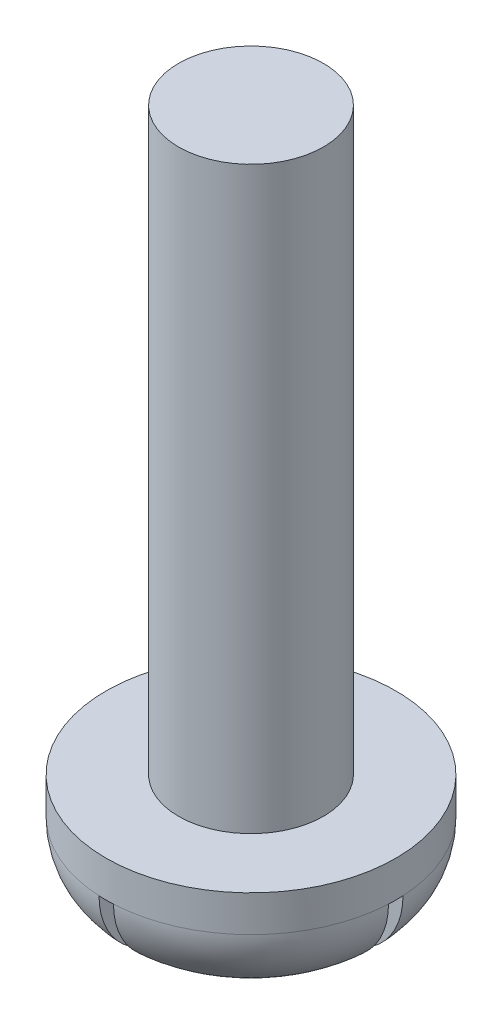
from build123d import *

# Parameters (mm, degrees)
SKETCH_1_R               = 2
EXTRUDE_1_DEPTH          = 1.5
SKETCH_2_R               = 1
EXTRUDE_2_DEPTH          = 8
CUT_EXTRUDE_1_DEPTH      = 10.912113801
CUT_EXTRUDE_1_DEPTH_BACK = 1
SKETCH_4_W               = 4
SKETCH_4_H               = 0.2
SKETCH_4_W_2             = 0.2
SKETCH_4_H_2             = 4
FILLET_1_R               = 1


with BuildPart() as part:
    # 草图1 → 凸台-拉伸1 (new body)
    with BuildSketch(Plane(origin=(0, 0, 0), x_dir=(1, 0, 0), z_dir=(0, 1, 0))):
        Circle(SKETCH_1_R)
    extrude(amount=-EXTRUDE_1_DEPTH)

    # 草图2 → 凸台-拉伸2 (add)
    with BuildSketch(Plane(origin=(0, 0, 0), x_dir=(1, 0, 0), z_dir=(0, 1, 0))):
        Circle(SKETCH_2_R)
    extrude(amount=EXTRUDE_2_DEPTH)

    # 草图4 → 切除-拉伸-薄壁1 (cut, two sides: drawn at the far end of the back side and taken through both)
    with BuildSketch(Plane.XZ.offset(1.5).offset(-CUT_EXTRUDE_1_DEPTH_BACK)):
        Rectangle(SKETCH_4_W, SKETCH_4_H)
        Rectangle(SKETCH_4_W_2, SKETCH_4_H_2)
    extrude(amount=CUT_EXTRUDE_1_DEPTH + CUT_EXTRUDE_1_DEPTH_BACK, mode=Mode.SUBTRACT)

    # 圆角1
    fillet_1_edges = [part.edges().sort_by_distance(p)[0] for p in [
        (1.414213562, -1.5, 1.414213562),
        (-1.414213562, -1.5, 1.414213562),
        (-1.414213562, -1.5, -1.414213562),
        (1.414213562, -1.5, -1.414213562),
    ]]
    fillet(fillet_1_edges, radius=FILLET_1_R)


solid = part.part
